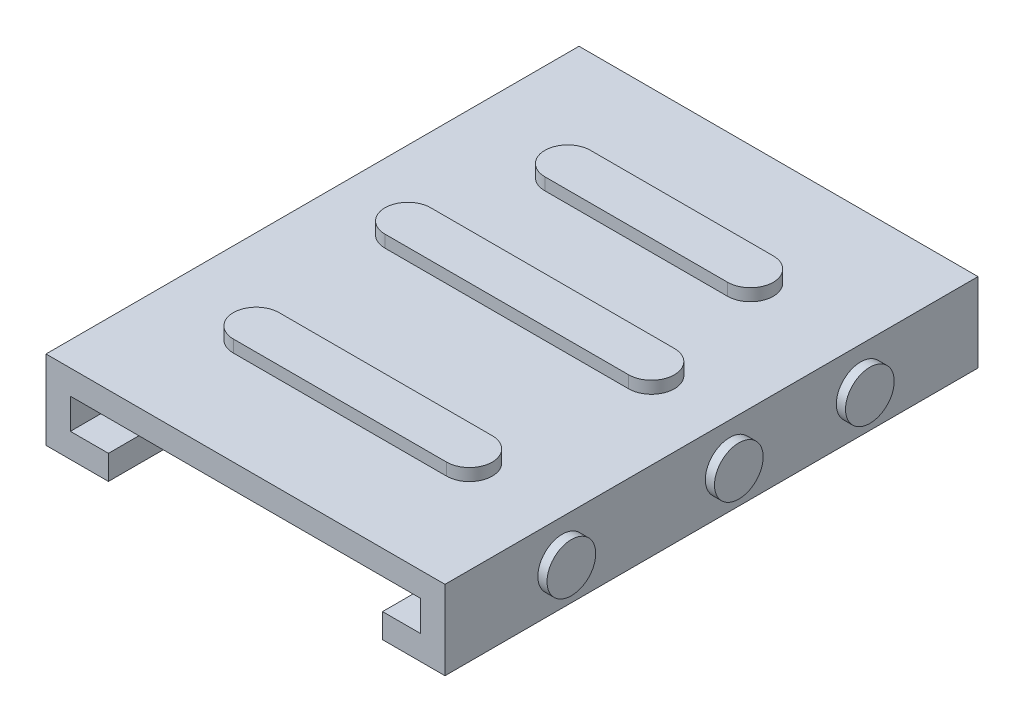
from build123d import *

# Parameters (mm, degrees)
BOSS_EXTRUDE1_DEPTH = 35
BOSS_EXTRUDE2_DEPTH = 0.8
SKETCH3_R           = 1.5
BOSS_EXTRUDE3_DEPTH = 0.6
SKETCH5_R           = 1.6
BOSS_EXTRUDE4_DEPTH = 0.6
SKETCH6_W           = 1.996397696
SKETCH6_H           = 1.346407749
SKETCH6_H_2         = 1.346407748
SKETCH6_W_2         = 2.042825549
BOSS_EXTRUDE5_DEPTH = 0.6


with BuildPart() as part:
    # Sketch1 → Boss-Extrude1 (new body)
    with BuildSketch(Plane.XY):
        Polygon((-59.64066795, 5.661190292), (-59.64066795, 7.261190292), (-62.14066795, 7.261190292), (-62.14066795, 9.261190292), (-39.14066795, 9.261190292), (-39.14066795, 7.261190292), (-41.64066795, 7.261190292), (-41.64066795, 5.661190292), (-37.54066795, 5.661190292), (-37.54066795, 10.861190292), (-63.74066795, 10.861190292), (-63.74066795, 5.661190292), align=None)
    extrude(amount=BOSS_EXTRUDE1_DEPTH)

    # Sketch2 → Boss-Extrude2 (add)
    with BuildSketch(Plane(origin=(0, 10.861190292, 0), x_dir=(1, 0, 0), z_dir=(0, 1, 0))):
        with BuildLine():
            Line((-56.64066795, -9.343006494), (-44.64066795, -9.343006494))
            ThreePointArc((-44.64066795, -9.343006494), (-43.14066795, -7.843006494), (-44.64066795, -6.343006494))
            Line((-44.64066795, -6.343006494), (-56.64066795, -6.343006494))
            ThreePointArc((-56.64066795, -6.343006494), (-58.14066795, -7.843006494), (-56.64066795, -9.343006494))
        make_face()
        with BuildLine():
            Line((-58.626258735, -17.853612356), (-42.626258735, -17.853612356))
            ThreePointArc((-42.626258735, -17.853612356), (-41.126258735, -16.353612356), (-42.626258735, -14.853612356))
            Line((-42.626258735, -14.853612356), (-58.626258735, -14.853612356))
            ThreePointArc((-58.626258735, -14.853612356), (-60.126258735, -16.353612356), (-58.626258735, -17.853612356))
        make_face()
        with BuildLine():
            Line((-57.64066795, -28.796277067), (-43.64066795, -28.796277067))
            ThreePointArc((-43.64066795, -28.796277067), (-42.14066795, -27.296277067), (-43.64066795, -25.796277067))
            Line((-43.64066795, -25.796277067), (-57.64066795, -25.796277067))
            ThreePointArc((-57.64066795, -25.796277067), (-59.14066795, -27.296277067), (-57.64066795, -28.796277067))
        make_face()
    extrude(amount=BOSS_EXTRUDE2_DEPTH)

    # Sketch3 → Boss-Extrude3 (add)
    with BuildSketch(Plane.ZY.offset(63.74066795)):
        with Locations((7.526452948, 8.261190292)):
            Circle(SKETCH3_R)
        with Locations((16.495470081, 8.261190292)):
            Circle(SKETCH3_R)
        with Locations((27.258290641, 8.261190292)):
            Circle(SKETCH3_R)
    extrude(amount=BOSS_EXTRUDE3_DEPTH)

    # Sketch5 → Boss-Extrude4 (add)
    with BuildSketch(Plane(origin=(-37.54066795, 0, 0), x_dir=(0, 0, -1), z_dir=(1, 0, 0))):
        with Locations((-27.301707085, 8.261190292)):
            Circle(SKETCH5_R)
        with Locations((-16.305217257, 8.261190292)):
            Circle(SKETCH5_R)
        with Locations((-7.70148216, 8.261190292)):
            Circle(SKETCH5_R)
    extrude(amount=BOSS_EXTRUDE4_DEPTH)

    # Sketch6 → Boss-Extrude5 (add)
    with BuildSketch(Plane.XZ.offset(-5.661190292)):
        with Locations((-39.381913502, 23.535620941)):
            Rectangle(SKETCH6_W, SKETCH6_H)
        with Locations((-61.713710985, 23.883829842)):
            Rectangle(SKETCH6_W, SKETCH6_H_2)
        with Locations((-61.713710985, 19.008905236)):
            Rectangle(SKETCH6_W, SKETCH6_H)
        with Locations((-61.713710985, 13.576846388)):
            Rectangle(SKETCH6_W, SKETCH6_H_2)
        with Locations((-61.690497059, 9.584050996)):
            Rectangle(SKETCH6_W_2, SKETCH6_H_2)
        with Locations((-39.381913502, 18.660696335)):
            Rectangle(SKETCH6_W, SKETCH6_H_2)
        with Locations((-39.381913502, 13.228637488)):
            Rectangle(SKETCH6_W, SKETCH6_H)
        with Locations((-39.358699576, 9.235842096)):
            Rectangle(SKETCH6_W_2, SKETCH6_H)
    extrude(amount=BOSS_EXTRUDE5_DEPTH)


solid = part.part
